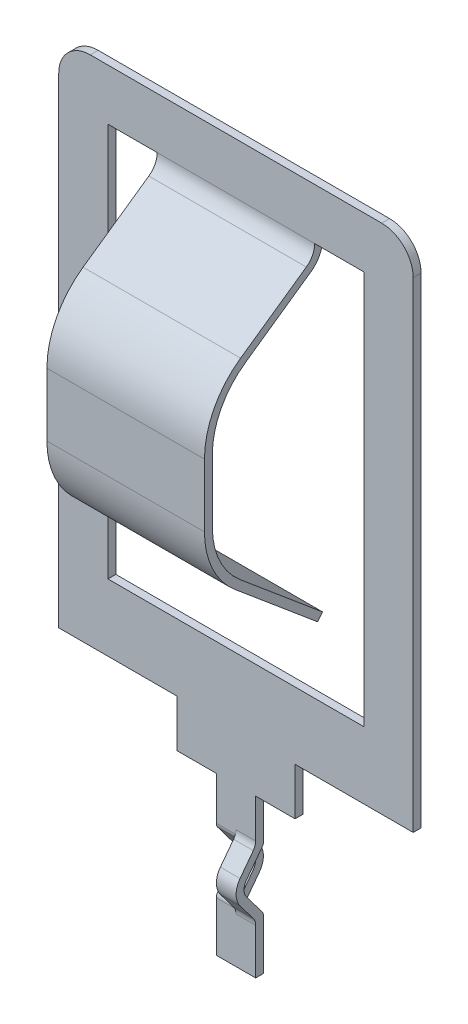
from build123d import *

# Parameters (mm, degrees)
SKETCH1_W           = 6.5
SKETCH1_H           = 10
BOSS_EXTRUDE1_DEPTH = 0.2
BOSS_EXTRUDE2_DEPTH = 2
BOSS_EXTRUDE3_DEPTH = 0.5
FILLET1_R           = 0.8
BOSS_EXTRUDE7_DEPTH = 0.5


with BuildPart() as part:
    # Sketch1 → Boss-Extrude1 (new body)
    with BuildSketch(Plane.XY):
        Polygon((-4.5, 0), (4.5, 0), (4.5, -13), (1.5, -13), (1.5, -14.2), (-1.5, -14.2), (-1.5, -13), (-4.5, -13), align=None)
        with Locations((0, -6.3)):
            Rectangle(SKETCH1_W, SKETCH1_H, mode=Mode.SUBTRACT)
    extrude(amount=BOSS_EXTRUDE1_DEPTH)

    # Sketch2 → Boss-Extrude2 (add, symmetric)
    with BuildSketch(Plane.ZY):
        with BuildLine():
            Line((2.8, -4.64068371), (2.8, -6.24068371))
            ThreePointArc((2.8, -6.24068371), (2.617192211, -7.065276361), (2.103024175, -7.73535319))
            Line((2.103024175, -7.73535319), (0, -9.5))
            Line((0, -9.5), (0.128557522, -9.653208889))
            Line((0.128557522, -9.653208889), (2.231581697, -7.888562079))
            ThreePointArc((2.231581697, -7.888562079), (2.798453768, -7.149800013), (3, -6.24068371))
            Line((3, -6.24068371), (3, -4.64068371))
            ThreePointArc((3, -4.64068371), (2.756943079, -3.647392057), (2.082697913, -2.878562796))
            Line((2.082697913, -2.878562796), (0.413211782, -1.709576022))
            ThreePointArc((0.413211782, -1.709576022), (0.256494583, -1.530874307), (0.2, -1.3))
            Line((0.2, -1.3), (0, -1.3))
            ThreePointArc((0, -1.3), (0.079092417, -1.623224029), (0.298496495, -1.873406431))
            Line((0.298496495, -1.873406431), (1.967982626, -3.042393205))
            ThreePointArc((1.967982626, -3.042393205), (2.579540912, -3.73974178), (2.8, -4.64068371))
        make_face()
    extrude(amount=BOSS_EXTRUDE2_DEPTH, both=True)

    # Sketch4 → Boss-Extrude3 (add)
    with BuildSketch(Plane.ZY):
        with BuildLine():
            Line((0.2, -14.2), (0, -14.2))
            Line((0, -14.2), (0, -15.295761219))
            ThreePointArc((0, -15.295761219), (0.009055652, -15.351444505), (0.035289283, -15.401388772))
            Line((0.035289283, -15.401388772), (0.436234874, -15.93446579))
            ThreePointArc((0.436234874, -15.93446579), (0.496480735, -16.114793139), (0.436234874, -16.295120487))
            Line((0.436234874, -16.295120487), (0.035289283, -16.828197505))
            ThreePointArc((0.035289283, -16.828197505), (0.009055652, -16.878141772), (0, -16.933825058))
            Line((0, -16.933825058), (0, -18.2))
            Line((0, -18.2), (0.2, -18.2))
            Line((0.2, -18.2), (0.2, -17.042162177))
            ThreePointArc((0.2, -17.042162177), (0.215459808, -16.947099676), (0.260245861, -16.861834829))
            Line((0.260245861, -16.861834829), (0.596070967, -16.415338719))
            ThreePointArc((0.596070967, -16.415338719), (0.696480735, -16.114793139), (0.596070967, -15.814247558))
            Line((0.596070967, -15.814247558), (0.260245861, -15.367751448))
            ThreePointArc((0.260245861, -15.367751448), (0.215459808, -15.282486601), (0.2, -15.1874241))
            Line((0.2, -15.1874241), (0.2, -14.2))
        make_face()
    extrude(amount=-BOSS_EXTRUDE3_DEPTH)

    # Fillet1
    fillet1_edges = [part.edges().sort_by_distance(p)[0] for p in [
        (-4.5, 0, 0.1),
        (4.5, 0, 0.1),
    ]]
    fillet(fillet1_edges, radius=FILLET1_R)

    # Sketch7 → Boss-Extrude7 (add)
    with BuildSketch(Plane.ZY):
        with BuildLine():
            Line((0, -14.2), (0.2, -14.2))
            Line((0.2, -14.2), (0.2, -15.295761219))
            ThreePointArc((0.2, -15.295761219), (0.190944348, -15.351444505), (0.164710717, -15.401388772))
            Line((0.164710717, -15.401388772), (-0.236234874, -15.93446579))
            ThreePointArc((-0.236234874, -15.93446579), (-0.296480735, -16.114793139), (-0.236234874, -16.295120487))
            Line((-0.236234874, -16.295120487), (0.164710717, -16.828197505))
            ThreePointArc((0.164710717, -16.828197505), (0.190944348, -16.878141772), (0.2, -16.933825058))
            Line((0.2, -16.933825058), (0.2, -18.2))
            Line((0.2, -18.2), (0, -18.2))
            Line((0, -18.2), (0, -17.042162177))
            ThreePointArc((0, -17.042162177), (-0.015459808, -16.947099676), (-0.060245861, -16.861834829))
            Line((-0.060245861, -16.861834829), (-0.396070967, -16.415338719))
            ThreePointArc((-0.396070967, -16.415338719), (-0.496480735, -16.114793139), (-0.396070967, -15.814247558))
            Line((-0.396070967, -15.814247558), (-0.060245861, -15.367751448))
            ThreePointArc((-0.060245861, -15.367751448), (-0.015459808, -15.282486601), (0, -15.1874241))
            Line((0, -15.1874241), (0, -14.2))
        make_face()
    extrude(amount=BOSS_EXTRUDE7_DEPTH)


solid = part.part
